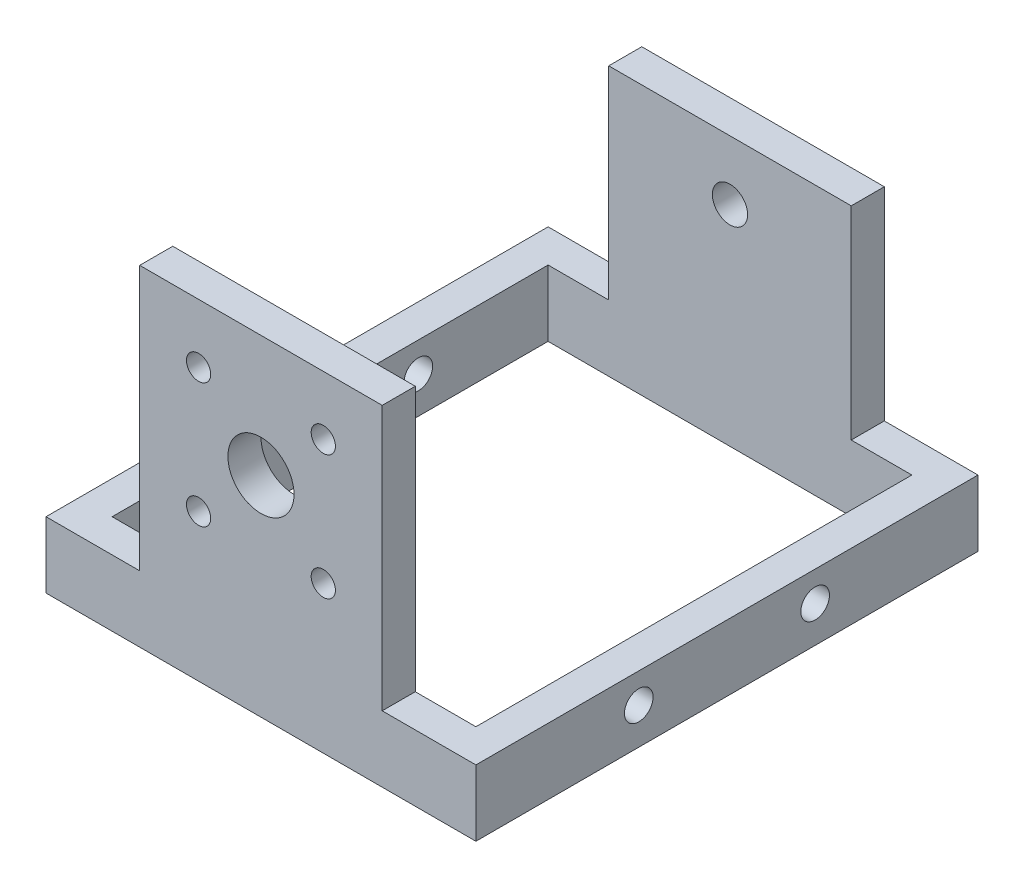
from build123d import *

# Parameters (mm, degrees)
BOSS_EXTRUDE1_DEPTH   = 6
BOSS_EXTRUDE1_2_DEPTH = 6
SKETCH1_3_W           = 22
SKETCH1_3_H           = 3
BOSS_EXTRUDE2_DEPTH   = 30
SKETCH1_4_W           = 22
SKETCH1_4_H           = 3
BOSS_EXTRUDE3_DEPTH   = 24.4
CUT_EXTRUDE1_REACH    = 56.219
SKETCH3_R             = 1.3
SKETCH4_R             = 1.6
CUT_EXTRUDE2_DEPTH    = 3
SKETCH5_R             = 3
SKETCH5_R_2           = 1.1
CUT_EXTRUDE3_DEPTH    = 3
CIRPATTERN1_COUNT     = 4


with BuildPart() as part:
    # Sketch1 → Boss-Extrude1 (new body)
    with BuildSketch(Plane(origin=(0, 0, 0), x_dir=(1, 0, 0), z_dir=(0, 1, 0))):
        Polygon((-11, 19.775), (-11, 22.775), (-19.5, 22.775), (-19.5, -22.775), (-11, -22.775), (-11, -19.775), (-16.5, -19.775), (-16.5, 19.775), align=None)
    extrude(amount=BOSS_EXTRUDE1_DEPTH)



with BuildPart() as body_2:
    # Sketch1 → Boss-Extrude1 2 (new body)
    with BuildSketch(Plane(origin=(0, 0, 0), x_dir=(1, 0, 0), z_dir=(0, 1, 0))):
        Polygon((19.5, -22.775), (19.5, 22.775), (11, 22.775), (11, 19.775), (16.5, 19.775), (16.5, -19.775), (11, -19.775), (11, -22.775), align=None)
    extrude(amount=BOSS_EXTRUDE1_2_DEPTH)


with BuildPart() as part_1:
    add(part.part)

    add(body_2.part)  # Boss-Extrude2 merges body 2
    # Sketch1<3> → Boss-Extrude2 (add)
    with BuildSketch(Plane(origin=(0, 0, 0), x_dir=(1, 0, 0), z_dir=(0, 1, 0))):
        with Locations((0, -21.275)):
            Rectangle(SKETCH1_3_W, SKETCH1_3_H)
    extrude(amount=BOSS_EXTRUDE2_DEPTH)

    # Sketch1<4> → Boss-Extrude3 (add)
    with BuildSketch(Plane(origin=(0, 0, 0), x_dir=(1, 0, 0), z_dir=(0, 1, 0))):
        with Locations((0, 21.275)):
            Rectangle(SKETCH1_4_W, SKETCH1_4_H)
    extrude(amount=BOSS_EXTRUDE3_DEPTH)

    # Cut-Extrude1: up to this face of the body (flat: up to its plane)
    cut_extrude1_end = Plane(part_1.part.faces().sort_by_distance((19.5, 3, 0))[0])
    # Sketch3 → Cut-Extrude1 (cut, up to the picked face)
    with BuildSketch(Plane.ZY.offset(19.5), mode=Mode.PRIVATE) as cut_extrude1_sk1:
        with Locations((-8, 3.3)):
            Circle(SKETCH3_R)
    cut_extrude1_tool1 = split(extrude(cut_extrude1_sk1.sketch, amount=-CUT_EXTRUDE1_REACH, mode=Mode.PRIVATE), bisect_by=cut_extrude1_end, keep=Keep.BOTH, mode=Mode.PRIVATE)
    # Sketch3 → Cut-Extrude1 (cut, up to the picked face)
    with BuildSketch(Plane.ZY.offset(19.5), mode=Mode.PRIVATE) as cut_extrude1_sk2:
        with Locations(Location((8, 3.3, 0), (0, 0, 180))):
            Circle(SKETCH3_R)
    cut_extrude1_tool2 = split(extrude(cut_extrude1_sk2.sketch, amount=-CUT_EXTRUDE1_REACH, mode=Mode.PRIVATE), bisect_by=cut_extrude1_end, keep=Keep.BOTH, mode=Mode.PRIVATE)
    add(cut_extrude1_tool1.solids().sort_by(Axis((-19.5, 3.3, -8), (1, 0, 0)))[0], mode=Mode.SUBTRACT)
    add(cut_extrude1_tool2.solids().sort_by(Axis((-19.5, 3.3, 8), (1, 0, 0)))[0], mode=Mode.SUBTRACT)

    # Sketch4 → Cut-Extrude2 (cut)
    with BuildSketch(Plane(origin=(0, 0, -22.775), x_dir=(-1, 0, 0), z_dir=(0, 0, -1))):
        with Locations((0, 19)):
            Circle(SKETCH4_R)
    extrude(amount=-CUT_EXTRUDE2_DEPTH, mode=Mode.SUBTRACT)

    # Sketch5 → Cut-Extrude3 (cut)
    with BuildSketch(Plane.XY.offset(22.775)):
        with Locations((0, 19)):
            Circle(SKETCH5_R)
        with Locations((5.656854249, 24.656854249)):
            Circle(SKETCH5_R_2)
    cut_extrude3 = extrude(amount=-CUT_EXTRUDE3_DEPTH, mode=Mode.SUBTRACT)

    # CirPattern1: Cut-Extrude3 ×4 about axis
    cirpattern1_axis = Axis((0, 19, 0), (0, 0, 1))
    for i in range(1, CIRPATTERN1_COUNT):
        add(cut_extrude3.rotate(cirpattern1_axis, i * 360 / CIRPATTERN1_COUNT), mode=Mode.SUBTRACT)


solid = part_1.part
